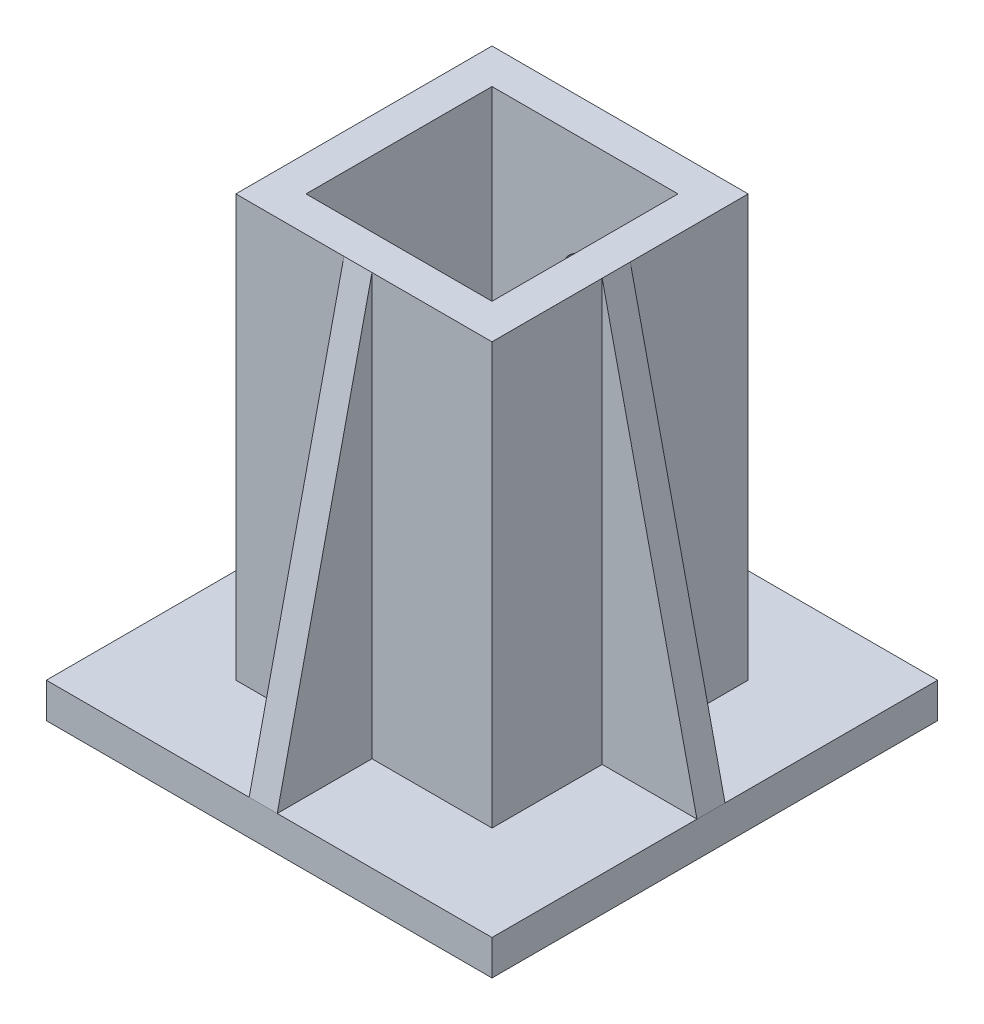
from build123d import *

# Parameters (mm, degrees)
SKETCH1_W               = 63.5
SKETCH1_H               = 63.5
BOSS_EXTRUDE1_DEPTH     = 5
SKETCH2_W               = 36.5
SKETCH2_H               = 36.5
SKETCH2_W_2             = 26.5
SKETCH2_H_2             = 26.5
BOSS_EXTRUDE2_DEPTH     = 60
SKETCH13_W              = 13.5
SKETCH13_H              = 4
BOSS_EXTRUDE3_DEPTH     = 60
CUT_EXTRUDE1_DEPTH      = 81.059680864
CUT_EXTRUDE1_DEPTH_BACK = 81.059680864
SKETCH15_W              = 13.5
SKETCH15_H              = 4
BOSS_EXTRUDE4_DEPTH     = 60
CUT_EXTRUDE3_DEPTH      = 81.059680864
CUT_EXTRUDE3_DEPTH_BACK = 81.059680864
SKETCH17_W              = 4
SKETCH17_H              = 13.5
BOSS_EXTRUDE5_DEPTH     = 60
CUT_EXTRUDE4_DEPTH      = 81.188668152
CUT_EXTRUDE4_DEPTH_BACK = 81.188668152
SKETCH21_R              = 3.175
CUT_EXTRUDE7_DEPTH      = 20


with BuildPart() as part:
    # Sketch1 → Boss-Extrude1 (new body)
    with BuildSketch(Plane(origin=(0, 0, 0), x_dir=(1, 0, 0), z_dir=(0, 1, 0))):
        Rectangle(SKETCH1_W, SKETCH1_H)
    extrude(amount=BOSS_EXTRUDE1_DEPTH)

    # Sketch2 → Boss-Extrude2 (add)
    with BuildSketch(Plane(origin=(0, 5, 0), x_dir=(1, 0, 0), z_dir=(0, 1, 0))):
        Rectangle(SKETCH2_W, SKETCH2_H)
        Rectangle(SKETCH2_W_2, SKETCH2_H_2, mode=Mode.SUBTRACT)
    extrude(amount=BOSS_EXTRUDE2_DEPTH)

    # Sketch13 → Boss-Extrude3 (add)
    with BuildSketch(Plane(origin=(0, 5, 0), x_dir=(1, 0, 0), z_dir=(0, 1, 0))):
        with Locations((-25, -0.55)):
            Rectangle(SKETCH13_W, SKETCH13_H)
    extrude(amount=BOSS_EXTRUDE3_DEPTH)

    # Sketch14 → Cut-Extrude1 (cut, two sides: drawn at the far end of the back side and taken through both)
    with BuildSketch(Plane.XY.offset(2.55).offset(-CUT_EXTRUDE1_DEPTH_BACK)):
        Polygon((-72.29949978, -175.219999022), (-31.75, 5), (-18.25, 65), (22.29949978, 245.219999022), (-338.140498264, 326.318998582), (-432.739497824, -94.120999462), align=None)
    extrude(amount=CUT_EXTRUDE1_DEPTH + CUT_EXTRUDE1_DEPTH_BACK, mode=Mode.SUBTRACT)

    # Sketch15 → Boss-Extrude4 (add)
    with BuildSketch(Plane(origin=(0, 5, 0), x_dir=(1, 0, 0), z_dir=(0, 1, 0))):
        with Locations((25, -0.55)):
            Rectangle(SKETCH15_W, SKETCH15_H)
    extrude(amount=BOSS_EXTRUDE4_DEPTH)

    # Sketch16 → Cut-Extrude3 (cut, two sides: drawn at the far end of the back side and taken through both)
    with BuildSketch(Plane.XY.offset(2.55).offset(-CUT_EXTRUDE3_DEPTH_BACK)):
        Polygon((72.29949978, -175.219999022), (31.75, 5), (18.25, 65), (-22.29949978, 245.219999022), (338.140498264, 326.318998582), (432.739497824, -94.120999462), align=None)
    extrude(amount=CUT_EXTRUDE3_DEPTH + CUT_EXTRUDE3_DEPTH_BACK, mode=Mode.SUBTRACT)

    # Sketch17 → Boss-Extrude5 (add)
    with BuildSketch(Plane(origin=(0, 5, 0), x_dir=(1, 0, 0), z_dir=(0, 1, 0))):
        with Locations((-0.85, -25)):
            Rectangle(SKETCH17_W, SKETCH17_H)
    extrude(amount=BOSS_EXTRUDE5_DEPTH)

    # Sketch18 → Cut-Extrude4 (cut, two sides: drawn at the far end of the back side and taken through both)
    with BuildSketch(Plane.ZY.offset(2.85).offset(-CUT_EXTRUDE4_DEPTH_BACK)):
        Polygon((72.29949978, -175.219999022), (31.75, 5), (18.25, 65), (-22.29949978, 245.219999022), (338.140498264, 326.318998582), (432.739497824, -94.120999462), align=None)
    extrude(amount=CUT_EXTRUDE4_DEPTH + CUT_EXTRUDE4_DEPTH_BACK, mode=Mode.SUBTRACT)

    # Sketch21 → Cut-Extrude7 (cut)
    with BuildSketch(Plane(origin=(0, 0, -18.25), x_dir=(-1, 0, 0), z_dir=(0, 0, -1))):
        with Locations((0, 17.739365868)):
            Circle(SKETCH21_R)
        with Locations((0, 47.466444019)):
            Circle(SKETCH21_R)
    extrude(amount=-CUT_EXTRUDE7_DEPTH, mode=Mode.SUBTRACT)


solid = part.part
